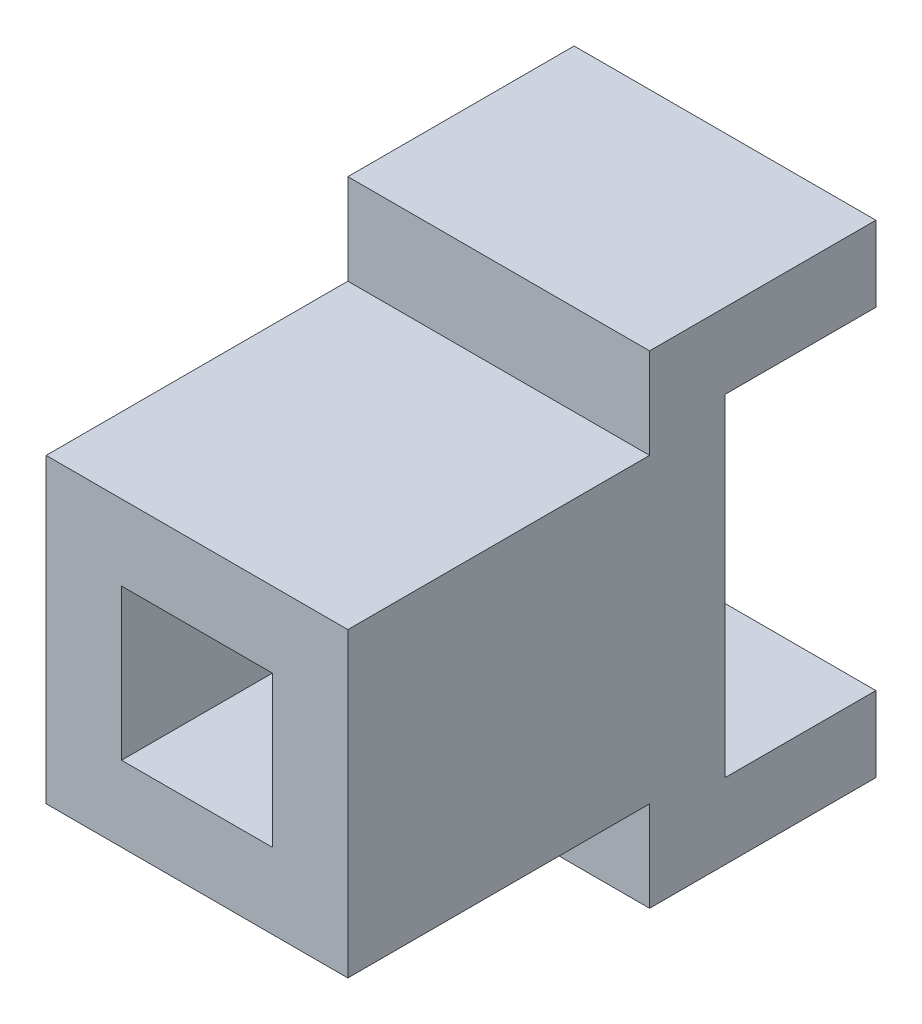
from build123d import *

# Parameters (mm, degrees)
SKETCH_1_W          = 20
SKETCH_1_H          = 20
EXTRUDE_1_DEPTH     = 20
SKETCH_3_W          = 10
SKETCH_3_H          = 10
CUT_EXTRUDE_1_DEPTH = 20
SKETCH_4_W          = 20
SKETCH_4_H          = 32
EXTRUDE_2_DEPTH     = 15
SKETCH_5_W          = 20
SKETCH_5_H          = 22
CUT_EXTRUDE_2_DEPTH = 10


with BuildPart() as part:
    # 草图1 → 凸台-拉伸1 (new body)
    with BuildSketch(Plane.XY):
        with Locations((10, 10)):
            Rectangle(SKETCH_1_W, SKETCH_1_H)
    extrude(amount=EXTRUDE_1_DEPTH)

    # 草图3 → 切除-拉伸1 (cut)
    with BuildSketch(Plane(origin=(0, 0, 0), x_dir=(-1, 0, 0), z_dir=(0, 0, -1))):
        with Locations((-10, 10)):
            Rectangle(SKETCH_3_W, SKETCH_3_H)
    extrude(amount=-CUT_EXTRUDE_1_DEPTH, mode=Mode.SUBTRACT)

    # 草图4 → 凸台-拉伸2 (add)
    with BuildSketch(Plane(origin=(0, 0, 0), x_dir=(-1, 0, 0), z_dir=(0, 0, -1))):
        with Locations((-10, 10)):
            Rectangle(SKETCH_4_W, SKETCH_4_H)
    extrude(amount=EXTRUDE_2_DEPTH)

    # 草图5 → 切除-拉伸2 (cut)
    with BuildSketch(Plane(origin=(0, 0, -15), x_dir=(-1, 0, 0), z_dir=(0, 0, -1))):
        with Locations((-10, 10)):
            Rectangle(SKETCH_5_W, SKETCH_5_H)
    extrude(amount=-CUT_EXTRUDE_2_DEPTH, mode=Mode.SUBTRACT)


solid = part.part
